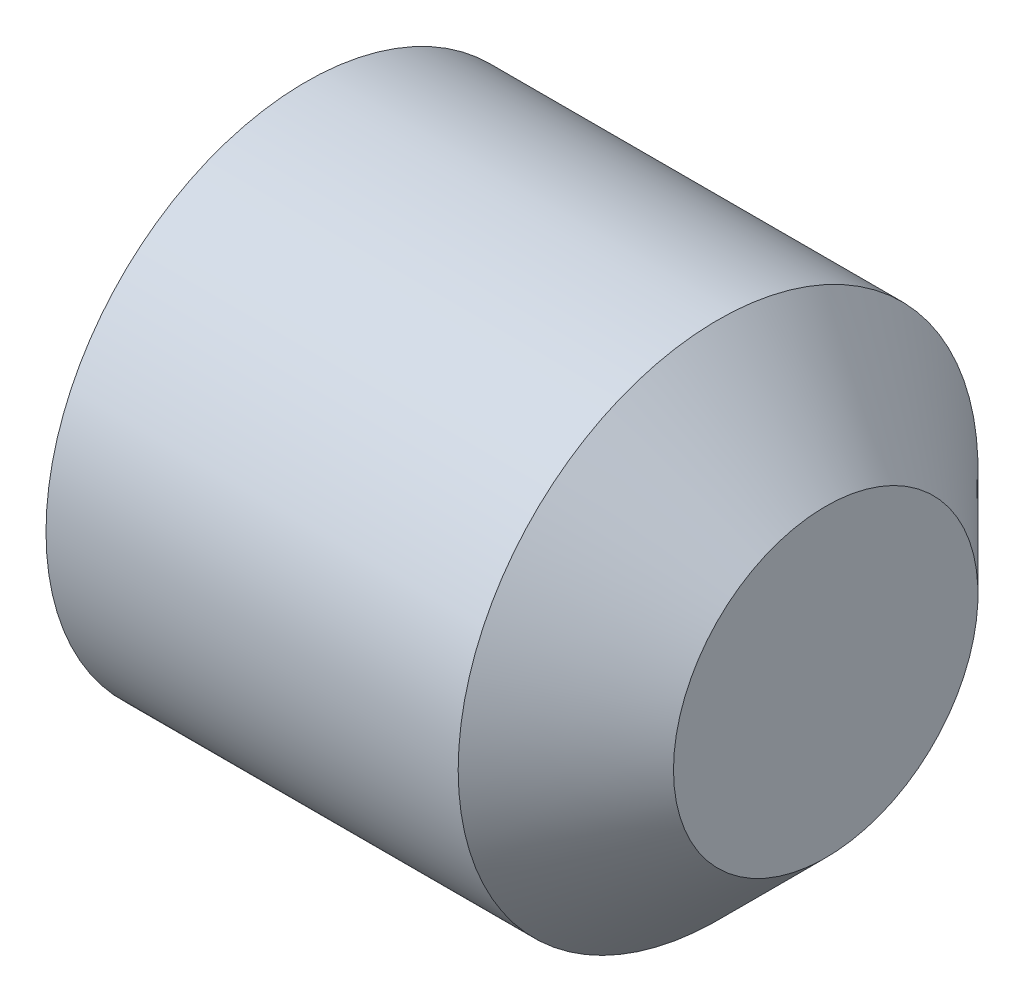
from build123d import *

# Parameters (mm, degrees)
CUT_EXTRUDE1_DEPTH = 2


with BuildPart() as part:
    # Sketch1 → Revolve1 (revolve)
    with BuildSketch(Plane.XY, mode=Mode.PRIVATE) as revolve1_sk:
        Polygon((6, 1.757359313), (6, 0), (0, 0), (0, 3), (4.757359313, 3), align=None)
    revolve(revolve1_sk.sketch.rotate(Axis((0, 0, 0), (1, 0, 0)), 90), axis=Axis((0, 0, 0), (1, 0, 0)))

    # Sketch2 → Cut-Extrude1 (cut)
    with BuildSketch(Plane.ZY):
        Polygon((-0.866025404, 1.5), (-1.732050808, 0), (-0.866025404, -1.5), (0.866025404, -1.5), (1.732050808, 0), (0.866025404, 1.5), align=None)
    extrude(amount=-CUT_EXTRUDE1_DEPTH, mode=Mode.SUBTRACT)


solid = part.part
